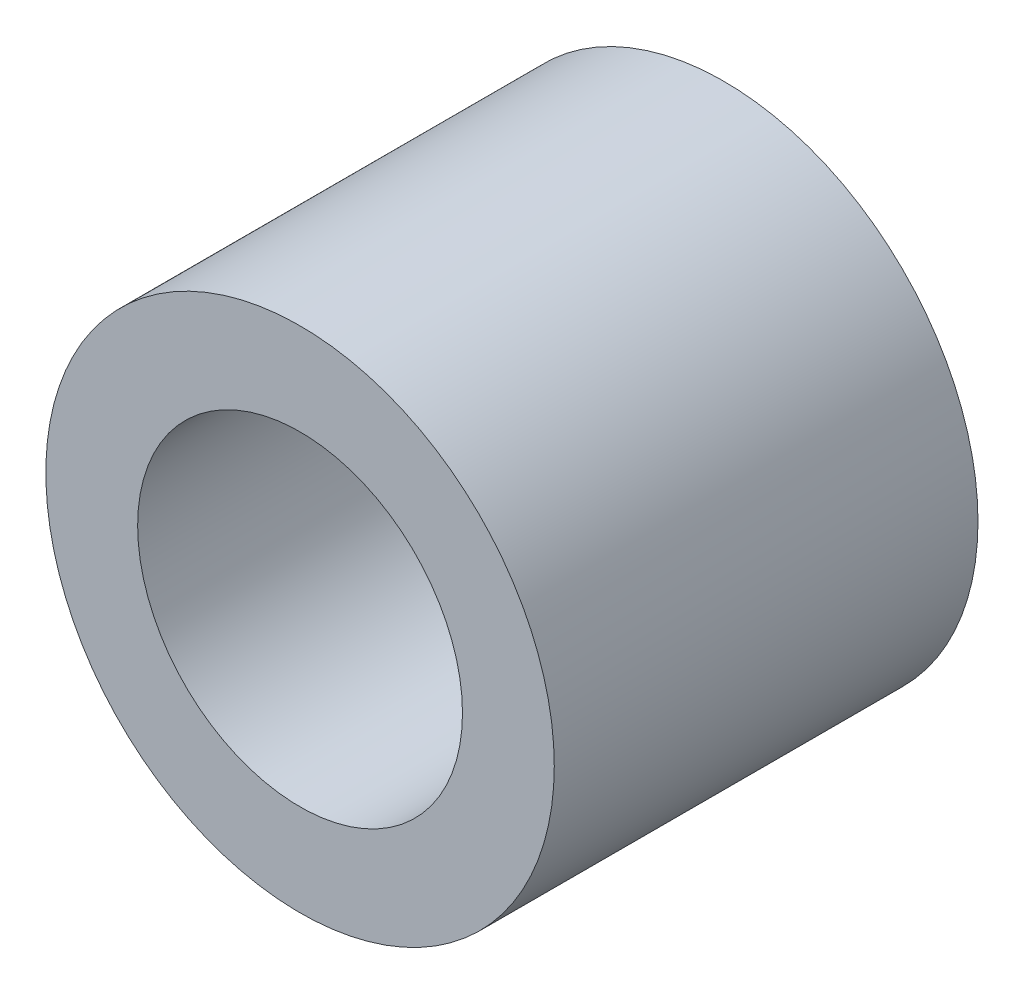
from build123d import *

# Parameters (mm, degrees)
SKIZZE1_R                       = 3.6
SKIZZE1_R_2                     = 2.3
AUFSATZ_LINEAR_AUSTRAGEN1_DEPTH = 6


with BuildPart() as part:
    # Skizze1 → Aufsatz-Linear austragen1 (new body)
    with BuildSketch(Plane.XY):
        Circle(SKIZZE1_R)
        Circle(SKIZZE1_R_2, mode=Mode.SUBTRACT)
    extrude(amount=AUFSATZ_LINEAR_AUSTRAGEN1_DEPTH)


solid = part.part
